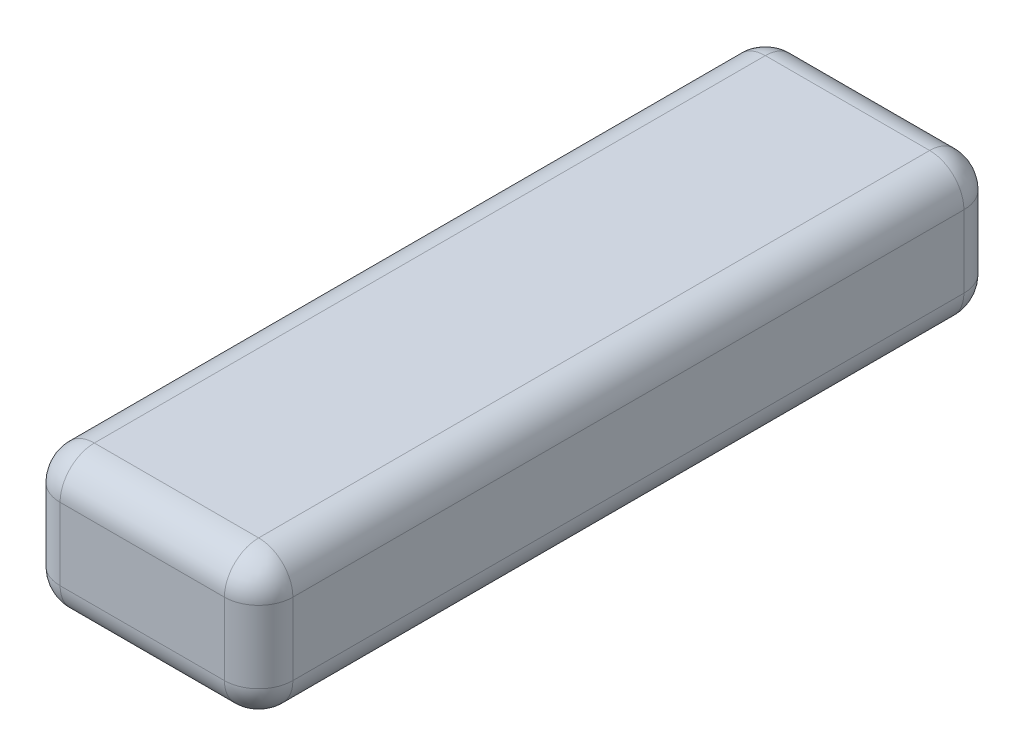
from build123d import *

# Parameters (mm, degrees)
BOSS_EXTRU_1_DEPTH      = 10.5
BOSS_EXTRU_1_DEPTH_BACK = 10.05
ESQUISSE1_W             = 34
ESQUISSE1_H             = 108
CONG_1_R                = 5
CONG_2_R                = 5


with BuildPart() as part:
    # Esquisse1 → Boss.-Extru.1 (new, two sides: drawn at the far end of the back side and taken through both)
    with BuildSketch(Plane(origin=(0, 0, 0), x_dir=(1, 0, 0), z_dir=(0, 1, 0)).offset(-BOSS_EXTRU_1_DEPTH_BACK)):
        Rectangle(ESQUISSE1_W, ESQUISSE1_H)
    extrude(amount=BOSS_EXTRU_1_DEPTH + BOSS_EXTRU_1_DEPTH_BACK)

    # Congé1
    cong_1_edges = [part.edges().sort_by_distance(p)[0] for p in [
        (17, 0.225, 54),
        (-17, 0.225, 54),
        (-17, 0.225, -54),
        (17, 0.225, -54),
    ]]
    fillet(cong_1_edges, radius=CONG_1_R)

    # Congé2
    cong_2_edges = [part.edges().sort_by_distance(p)[0] for p in [
        (17, 10.5, 0),
        (17, -10.05, 0),
        (0, 10.5, -54),
        (-17, 10.5, 0),
        (0, 10.5, 54),
        (15.535533906, 10.5, 52.535533906),
        (-15.535533906, 10.5, 52.535533906),
        (-15.535533906, 10.5, -52.535533906),
        (15.535533906, 10.5, -52.535533906),
        (0, -10.05, -54),
        (0, -10.05, 54),
        (-17, -10.05, 0),
        (15.535533906, -10.05, 52.535533906),
        (-15.535533906, -10.05, 52.535533906),
        (-15.535533906, -10.05, -52.535533906),
        (15.535533906, -10.05, -52.535533906),
    ]]
    fillet(cong_2_edges, radius=CONG_2_R)


solid = part.part
